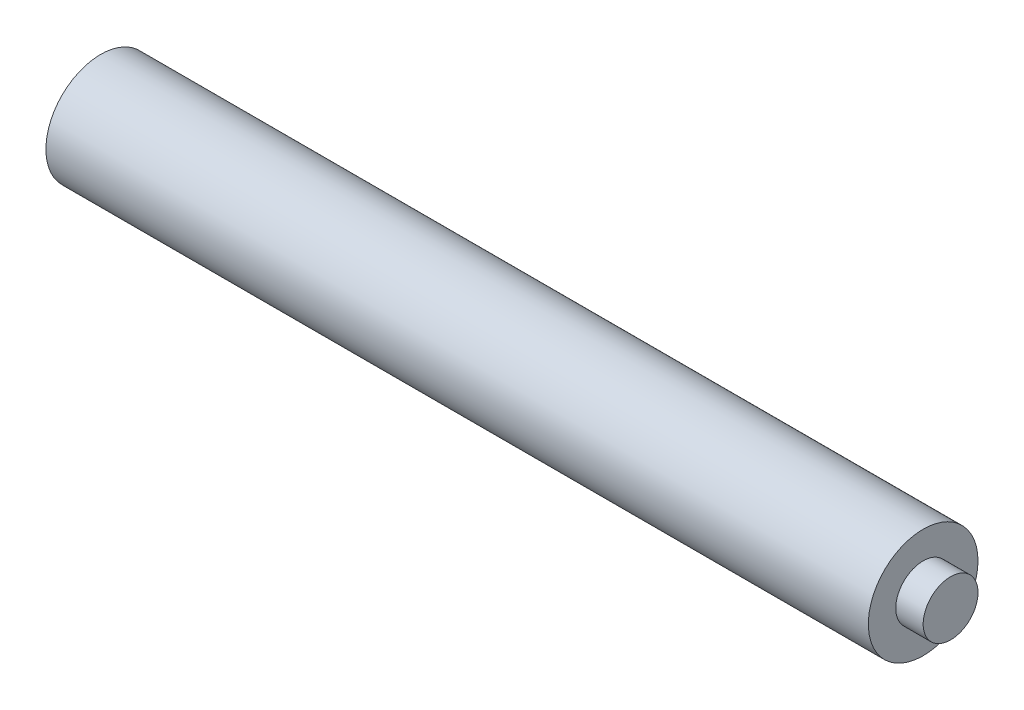
from build123d import *

# Parameters (mm, degrees)
SKETCH1_R           = 4
BOSS_EXTRUDE1_DEPTH = 30
SKETCH2_R           = 2
BOSS_EXTRUDE2_DEPTH = 2


with BuildPart() as part:
    # Sketch1 → Boss-Extrude1 (new, symmetric)
    with BuildSketch(Plane(origin=(0, 0, 0), x_dir=(0, 0, -1), z_dir=(1, 0, 0))):
        Circle(SKETCH1_R)
    extrude(amount=BOSS_EXTRUDE1_DEPTH, both=True)

    # Sketch2 → Boss-Extrude2 (add)
    with BuildSketch(Plane(origin=(30, 0, 0), x_dir=(0, 0, -1), z_dir=(1, 0, 0))):
        Circle(SKETCH2_R)
    extrude(amount=BOSS_EXTRUDE2_DEPTH)


solid = part.part
